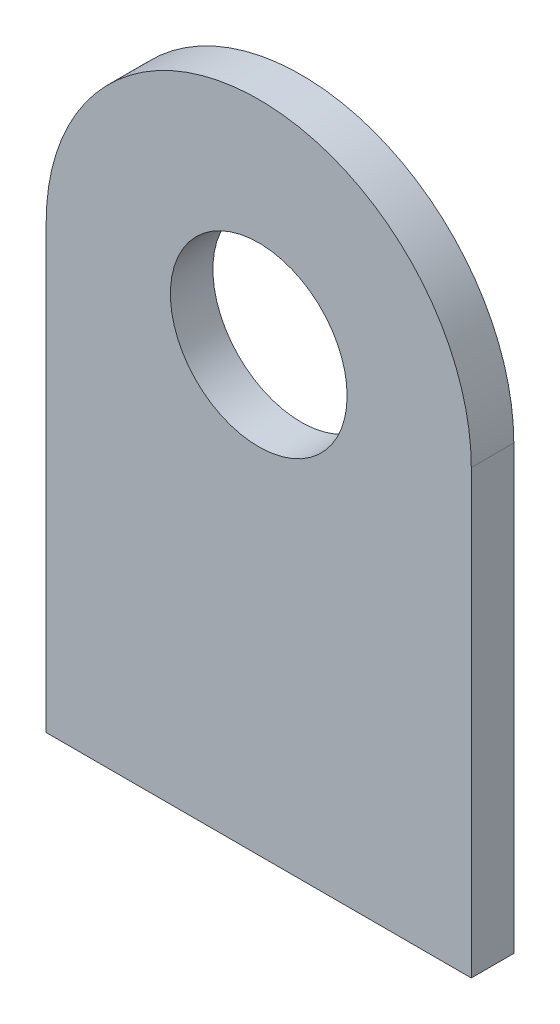
from build123d import *

# Parameters (mm, degrees)
SKETCH1_R            = 7.9375
SKETCH1_R_2          = 3
BOSS_EXTRUDE1_DEPTH  = 1.5875
M6_CLEARANCE_HOLE1_D = 6.6


with BuildPart() as part:
    # Sketch1 → Boss-Extrude1 (new body)
    # profile 1 of 3: a face of its own
    with BuildSketch(Plane.XY):
        Circle(SKETCH1_R)
        Circle(SKETCH1_R_2, mode=Mode.SUBTRACT)
    # profile 2 of 3: a face of its own
    with BuildSketch(Plane.XY):
        with BuildLine():
            ThreePointArc((7.9375, 0), (0, -7.9375), (-7.9375, 0))
            Line((-7.9375, 0), (-7.9375, -16.51))
            Line((-7.9375, -16.51), (7.9375, -16.51))
            Line((7.9375, -16.51), (7.9375, 0))
        make_face()
    # profile 3 of 3: a face of its own
    with BuildSketch(Plane.XY):
        Circle(SKETCH1_R_2)
    extrude(amount=BOSS_EXTRUDE1_DEPTH)

    # M6 Clearance Hole1 (through all)
    with Locations(Plane.XY.offset(1.5875)):
        with Locations((0, 0)):
            Hole(M6_CLEARANCE_HOLE1_D / 2)


solid = part.part
